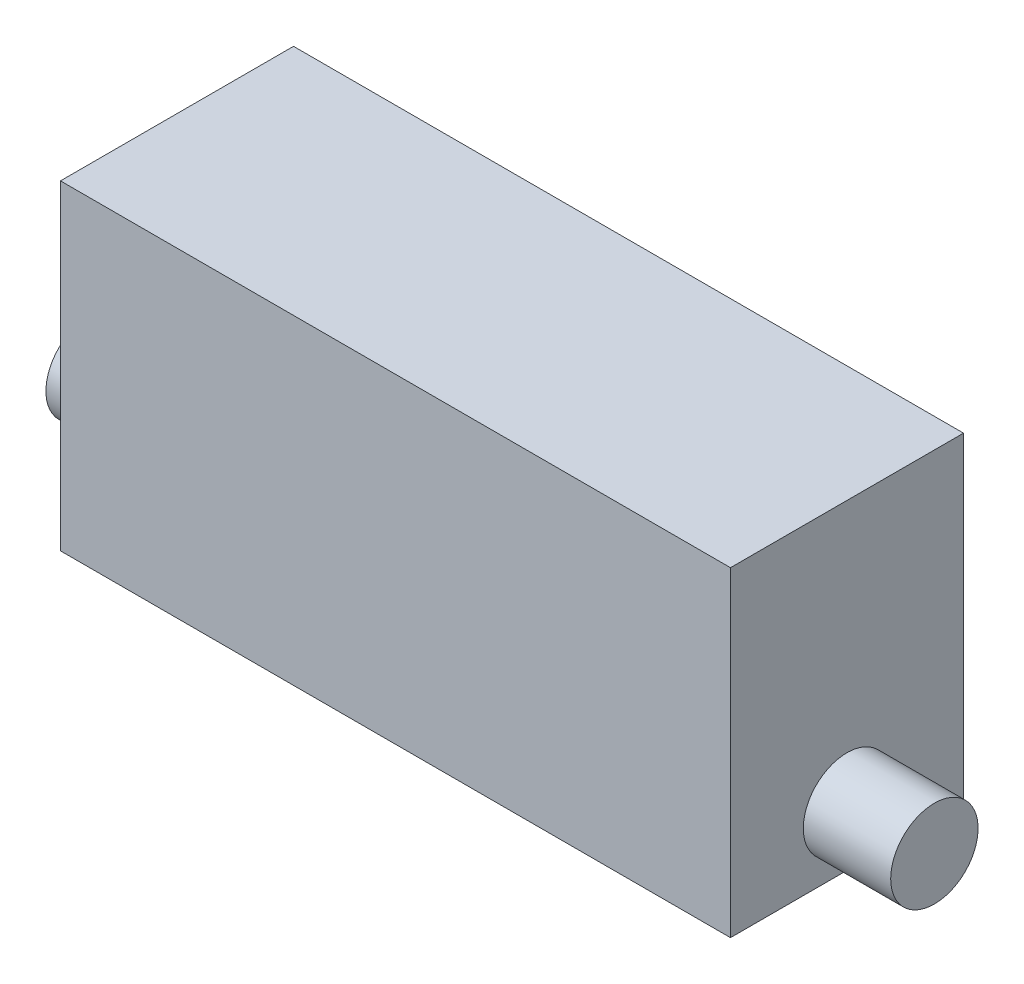
from build123d import *

# Parameters (mm, degrees)
SKETCH1_W           = 146.05
SKETCH1_H           = 50.8
BOSS_EXTRUDE1_DEPTH = 69.85
SKETCH2_R           = 9.525
BOSS_EXTRUDE2_DEPTH = 19.05
BOSS_EXTRUDE3_START = 19.05
SKETCH3_R           = 9.525
BOSS_EXTRUDE3_DEPTH = 19.05


with BuildPart() as part:
    # Sketch1 → Boss-Extrude1 (new body)
    with BuildSketch(Plane(origin=(0, 0, 0), x_dir=(1, 0, 0), z_dir=(0, 1, 0))):
        with Locations((73.025, 25.4)):
            Rectangle(SKETCH1_W, SKETCH1_H)
    extrude(amount=BOSS_EXTRUDE1_DEPTH)

    # Sketch2 → Boss-Extrude2 (add)
    with BuildSketch(Plane(origin=(146.05, 0, 0), x_dir=(0, 0, -1), z_dir=(1, 0, 0))):
        with Locations(Location((25.4, 12.7, 0), (0, 0, 180))):
            Circle(SKETCH2_R)
    extrude(amount=BOSS_EXTRUDE2_DEPTH)

    # Sketch3 → Boss-Extrude3 (add)
    with BuildSketch(Plane.ZY.offset(BOSS_EXTRUDE3_START)):
        with Locations((-25.4, 12.7)):
            Circle(SKETCH3_R)
    extrude(amount=-BOSS_EXTRUDE3_DEPTH)


solid = part.part
